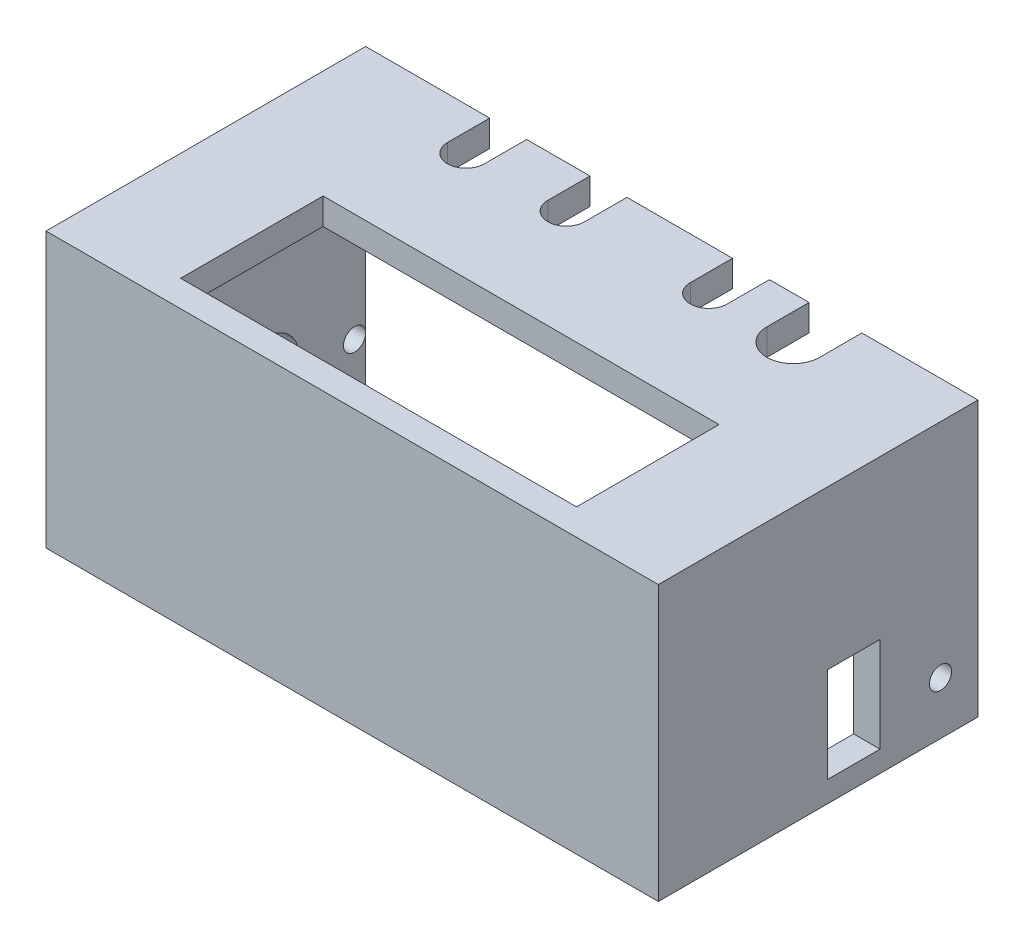
from build123d import *

# Parameters (mm, degrees)
BOSS_EXTRUDE1_DEPTH             = 47
SKETCH3_W                       = 84.887301628
SKETCH3_H                       = 42
CUT_EXTRUDE1_DEPTH              = 40
SKETCH4_W                       = 55.556349186
SKETCH4_H                       = 42
CUT_EXTRUDE2_DEPTH              = 10.556349186
SKETCH5_W                       = 55.556349186
SKETCH5_H                       = 42
CUT_EXTRUDE3_DEPTH              = 10.556349186
CUT_EXTRUDE5_REACH              = 130.666
SKETCH7_W                       = 10
SKETCH7_H                       = 18
CUT_EXTRUDE6_REACH              = 135.004
SKETCH8_R                       = 6.5
BOSS_EXTRUDE2_DEPTH             = 5
CUT_EXTRUDE7_REACH              = 105.666
CUT_EXTRUDE7_START              = -5
SKETCH11_W                      = 106
SKETCH11_H                      = 47
BOSS_EXTRUDE3_DEPTH             = 5
CUT_EXTRUDE8_REACH              = 91.961
CUT_EXTRUDE9_REACH              = 91.961
SKETCH14_W                      = 75
SKETCH14_H                      = 27
CUT_EXTRUDE10_REACH             = 136.852
SKETCH16_R                      = 2.1
CUT_EXTRUDE10_DIRECTION_2_DEPTH = 135.851770474
CUT_EXTRUDE11_REACH             = 136.852
SKETCH17_R                      = 2.1


with BuildPart() as part:
    # Sketch1 → Boss-Extrude1 (new body)
    with BuildSketch(Plane(origin=(0, 0, 0), x_dir=(1, 0, 0), z_dir=(0, 1, 0))):
        Polygon((-42.443650814, 0), (42.443650814, 0), (58, 15.556349186), (58, -45), (-58, -45), (-58, 15.556349186), align=None)
    extrude(amount=BOSS_EXTRUDE1_DEPTH)

    # Sketch3 → Cut-Extrude1 (cut)
    with BuildSketch(Plane(origin=(0, 0, 0), x_dir=(-1, 0, 0), z_dir=(0, 0, -1))):
        with Locations((0, 21)):
            Rectangle(SKETCH3_W, SKETCH3_H)
    extrude(amount=-CUT_EXTRUDE1_DEPTH, mode=Mode.SUBTRACT)

    # Sketch4 → Cut-Extrude2 (cut)
    with BuildSketch(Plane.ZY.offset(-42.443650814)):
        with Locations((12.221825407, 21)):
            Rectangle(SKETCH4_W, SKETCH4_H)
    extrude(amount=-CUT_EXTRUDE2_DEPTH, mode=Mode.SUBTRACT)

    # Sketch5 → Cut-Extrude3 (cut)
    with BuildSketch(Plane(origin=(-42.443650814, 0, 0), x_dir=(0, 0, -1), z_dir=(1, 0, 0))):
        with Locations((-12.221825407, 21)):
            Rectangle(SKETCH5_W, SKETCH5_H)
    extrude(amount=-CUT_EXTRUDE3_DEPTH, mode=Mode.SUBTRACT)

    # Sketch7 → Cut-Extrude5 (cut, up to next)
    with BuildSketch(Plane.ZY.offset(-53), mode=Mode.PRIVATE) as cut_extrude5_sk1:
        with Locations((8, 13)):
            Rectangle(SKETCH7_W, SKETCH7_H)
    cut_extrude5_tool1 = extrude(cut_extrude5_sk1.sketch, amount=-CUT_EXTRUDE5_REACH, mode=Mode.PRIVATE) & part.part
    add(cut_extrude5_tool1.solids().sort_by_distance((53, 13, 8))[0], mode=Mode.SUBTRACT)

    # Sketch8 → Cut-Extrude6 (cut, up to next)
    with BuildSketch(Plane.ZY.offset(58), mode=Mode.PRIVATE) as cut_extrude6_sk1:
        with Locations((8.5, 12.301549083)):
            Circle(SKETCH8_R)
    cut_extrude6_tool1 = extrude(cut_extrude6_sk1.sketch, amount=-CUT_EXTRUDE6_REACH, mode=Mode.PRIVATE) & part.part
    add(cut_extrude6_tool1.solids().sort_by_distance((-58, 12.301549, 8.5))[0], mode=Mode.SUBTRACT)

    # Sketch10 → Boss-Extrude2 (add)
    with BuildSketch(Plane(origin=(0, 47, 0), x_dir=(1, 0, 0), z_dir=(0, 1, 0))):
        Polygon((58, -45), (-58, -45), (-58, 15.556349186), (-42.443650814, 0), (42.443650814, 0), (58, 15.556349186), align=None)
    extrude(amount=BOSS_EXTRUDE2_DEPTH)

    # Sketch11 → Cut-Extrude7 (cut, up to next)
    with BuildSketch(Plane.XY.offset(45).offset(CUT_EXTRUDE7_START), mode=Mode.PRIVATE) as cut_extrude7_sk1:
        with Locations((0, 23.5)):
            Rectangle(SKETCH11_W, SKETCH11_H)
    cut_extrude7_tool1 = extrude(cut_extrude7_sk1.sketch, amount=-CUT_EXTRUDE7_REACH, mode=Mode.PRIVATE) & part.part
    add(cut_extrude7_tool1.solids().sort_by_distance((0, 23.5, 40))[0], mode=Mode.SUBTRACT)

    # Sketch12 → Boss-Extrude3 (add)
    with BuildSketch(Plane(origin=(0, 52, 0), x_dir=(1, 0, 0), z_dir=(0, 1, 0))):
        Polygon((58, 15.556349186), (42.443650814, 0), (-42.443650814, 0), (-58, 15.556349186), align=None)
    extrude(amount=-BOSS_EXTRUDE3_DEPTH)

    # Sketch13 → Cut-Extrude8 (cut, up to next)
    with BuildSketch(Plane(origin=(0, 52, 0), x_dir=(1, 0, 0), z_dir=(0, 1, 0)), mode=Mode.PRIVATE) as cut_extrude8_sk1:
        with BuildLine():
            Line((26, 7.556349186), (26, 15.556349186))
            ThreePointArc((26, 15.556349186), (31, 20.556349186), (36, 15.556349186))
            Line((36, 15.556349186), (36, 7.556349186))
            ThreePointArc((36, 7.556349186), (31, 2.556349186), (26, 7.556349186))
        make_face()
    cut_extrude8_tool1 = extrude(cut_extrude8_sk1.sketch, amount=-CUT_EXTRUDE8_REACH, mode=Mode.PRIVATE) & part.part
    # Sketch13 → Cut-Extrude8 (cut, up to next)
    with BuildSketch(Plane(origin=(0, 52, 0), x_dir=(1, 0, 0), z_dir=(0, 1, 0)), mode=Mode.PRIVATE) as cut_extrude8_sk2:
        with BuildLine():
            Line((11.5, 7.556349186), (11.5, 15.556349186))
            ThreePointArc((11.5, 15.556349186), (15, 19.056349186), (18.5, 15.556349186))
            Line((18.5, 15.556349186), (18.5, 7.556349186))
            ThreePointArc((18.5, 7.556349186), (15, 4.056349186), (11.5, 7.556349186))
        make_face()
    cut_extrude8_tool2 = extrude(cut_extrude8_sk2.sketch, amount=-CUT_EXTRUDE8_REACH, mode=Mode.PRIVATE) & part.part
    # Sketch13 → Cut-Extrude8 (cut, up to next)
    with BuildSketch(Plane(origin=(0, 52, 0), x_dir=(1, 0, 0), z_dir=(0, 1, 0)), mode=Mode.PRIVATE) as cut_extrude8_sk3:
        with BuildLine():
            Line((-15.5, 7.556349186), (-15.5, 15.556349186))
            ThreePointArc((-15.5, 15.556349186), (-12, 19.056349186), (-8.5, 15.556349186))
            Line((-8.5, 15.556349186), (-8.5, 7.556349186))
            ThreePointArc((-8.5, 7.556349186), (-12, 4.056349186), (-15.5, 7.556349186))
        make_face()
    cut_extrude8_tool3 = extrude(cut_extrude8_sk3.sketch, amount=-CUT_EXTRUDE8_REACH, mode=Mode.PRIVATE) & part.part
    # Sketch13 → Cut-Extrude8 (cut, up to next)
    with BuildSketch(Plane(origin=(0, 52, 0), x_dir=(1, 0, 0), z_dir=(0, 1, 0)), mode=Mode.PRIVATE) as cut_extrude8_sk4:
        with BuildLine():
            Line((-34.5, 7.556349186), (-34.5, 15.556349186))
            ThreePointArc((-34.5, 15.556349186), (-31, 19.056349186), (-27.5, 15.556349186))
            Line((-27.5, 15.556349186), (-27.5, 7.556349186))
            ThreePointArc((-27.5, 7.556349186), (-31, 4.056349186), (-34.5, 7.556349186))
        make_face()
    cut_extrude8_tool4 = extrude(cut_extrude8_sk4.sketch, amount=-CUT_EXTRUDE8_REACH, mode=Mode.PRIVATE) & part.part
    add(cut_extrude8_tool1.solids().sort_by_distance((31, 52, -11.556349))[0], mode=Mode.SUBTRACT)
    add(cut_extrude8_tool2.solids().sort_by_distance((15, 52, -11.556349))[0], mode=Mode.SUBTRACT)
    add(cut_extrude8_tool3.solids().sort_by_distance((-12, 52, -11.556349))[0], mode=Mode.SUBTRACT)
    add(cut_extrude8_tool4.solids().sort_by_distance((-31, 52, -11.556349))[0], mode=Mode.SUBTRACT)

    # Sketch14 → Cut-Extrude9 (cut, up to next)
    with BuildSketch(Plane(origin=(0, 52, 0), x_dir=(1, 0, 0), z_dir=(0, 1, 0)), mode=Mode.PRIVATE) as cut_extrude9_sk1:
        with Locations((0, -26.5)):
            Rectangle(SKETCH14_W, SKETCH14_H)
    cut_extrude9_tool1 = extrude(cut_extrude9_sk1.sketch, amount=-CUT_EXTRUDE9_REACH, mode=Mode.PRIVATE) & part.part
    add(cut_extrude9_tool1.solids().sort_by_distance((0, 52, 26.5))[0], mode=Mode.SUBTRACT)

    # Sketch16 → Cut-Extrude10 (cut, up to next)
    with BuildSketch(Plane(origin=(58, 0, 0), x_dir=(0, 0, -1), z_dir=(1, 0, 0)), mode=Mode.PRIVATE) as cut_extrude10_sk1:
        with Locations(Location((8.456349186, 10, 0), (0, 0, 180))):
            Circle(SKETCH16_R)
    cut_extrude10_tool1 = extrude(cut_extrude10_sk1.sketch, amount=-CUT_EXTRUDE10_REACH, mode=Mode.PRIVATE) & part.part
    add(cut_extrude10_tool1.solids().sort_by_distance((58, 10, -8.456349))[0], mode=Mode.SUBTRACT)

    # Sketch16 → Cut-Extrude10 direction 2 (cut)
    with BuildSketch(Plane(origin=(58, 0, 0), x_dir=(0, 0, -1), z_dir=(1, 0, 0))):
        with Locations(Location((8.456349186, 10, 0), (0, 0, 180))):
            Circle(SKETCH16_R)
    extrude(amount=CUT_EXTRUDE10_DIRECTION_2_DEPTH, mode=Mode.SUBTRACT)

    # Sketch17 → Cut-Extrude11 (cut, up to next)
    with BuildSketch(Plane.ZY.offset(58), mode=Mode.PRIVATE) as cut_extrude11_sk1:
        with Locations((-8.456349186, 10)):
            Circle(SKETCH17_R)
    cut_extrude11_tool1 = extrude(cut_extrude11_sk1.sketch, amount=-CUT_EXTRUDE11_REACH, mode=Mode.PRIVATE) & part.part
    add(cut_extrude11_tool1.solids().sort_by_distance((-58, 10, -8.456349))[0], mode=Mode.SUBTRACT)


solid = part.part
